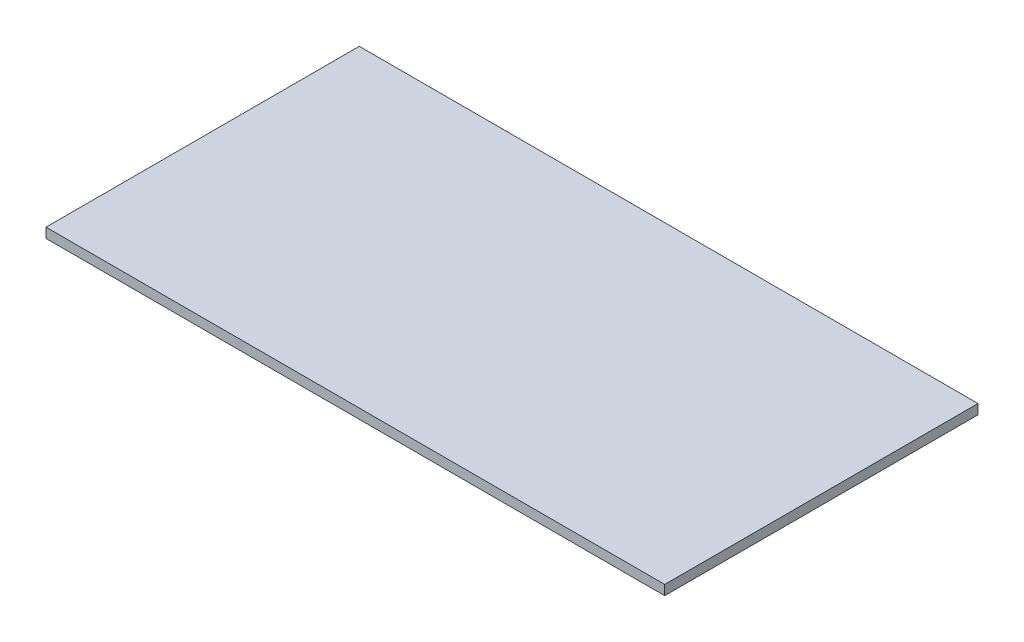
from build123d import *

# Parameters (mm, degrees)
SKETCH1_W           = 200.66
SKETCH1_H           = 101.6
BOSS_EXTRUDE1_DEPTH = 3.175


with BuildPart() as part:
    # Sketch1 → Boss-Extrude1 (new body)
    with BuildSketch(Plane(origin=(0, 0, 0), x_dir=(1, 0, 0), z_dir=(0, 1, 0))):
        with Locations((100.33, 88.6257277)):
            Rectangle(SKETCH1_W, SKETCH1_H)
    extrude(amount=BOSS_EXTRUDE1_DEPTH)


solid = part.part
